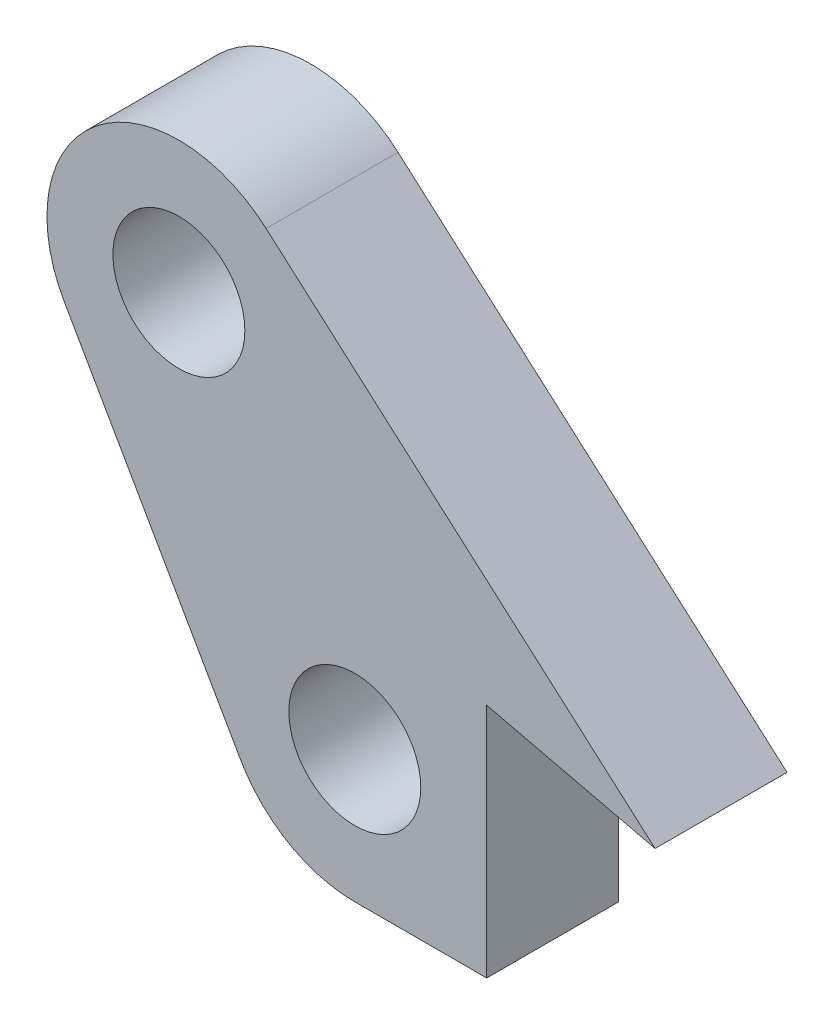
from build123d import *

# Parameters (mm, degrees)
SKETCH1_R           = 1.5
BOSS_EXTRUDE1_DEPTH = 3


with BuildPart() as part:
    # Sketch1 → Boss-Extrude1 (new body)
    with BuildSketch(Plane.XY):
        with BuildLine():
            Line((-20.398188463, 8.511583185), (-16.398188463, 1.511583185))
            ThreePointArc((-16.398188463, 1.511583185), (-15.299239491, 0.405269721), (-13.793459037, 0))
            Line((-13.793459037, 0), (-10.793459037, 0))
            Line((-10.793459037, 0), (-10.793459037, 5.371708245))
            Line((-10.793459037, 5.371708245), (-6.965474487, 4.463821993))
            Line((-6.965474487, 4.463821993), (-15.811037483, 12.251667113))
            ThreePointArc((-15.811037483, 12.251667113), (-19.689210528, 12.3251078), (-20.398188463, 8.511583185))
        make_face()
        with Locations((-17.793459037, 10)):
            Circle(SKETCH1_R, mode=Mode.SUBTRACT)
        with Locations((-13.793459037, 3)):
            Circle(SKETCH1_R, mode=Mode.SUBTRACT)
    extrude(amount=BOSS_EXTRUDE1_DEPTH)


solid = part.part
